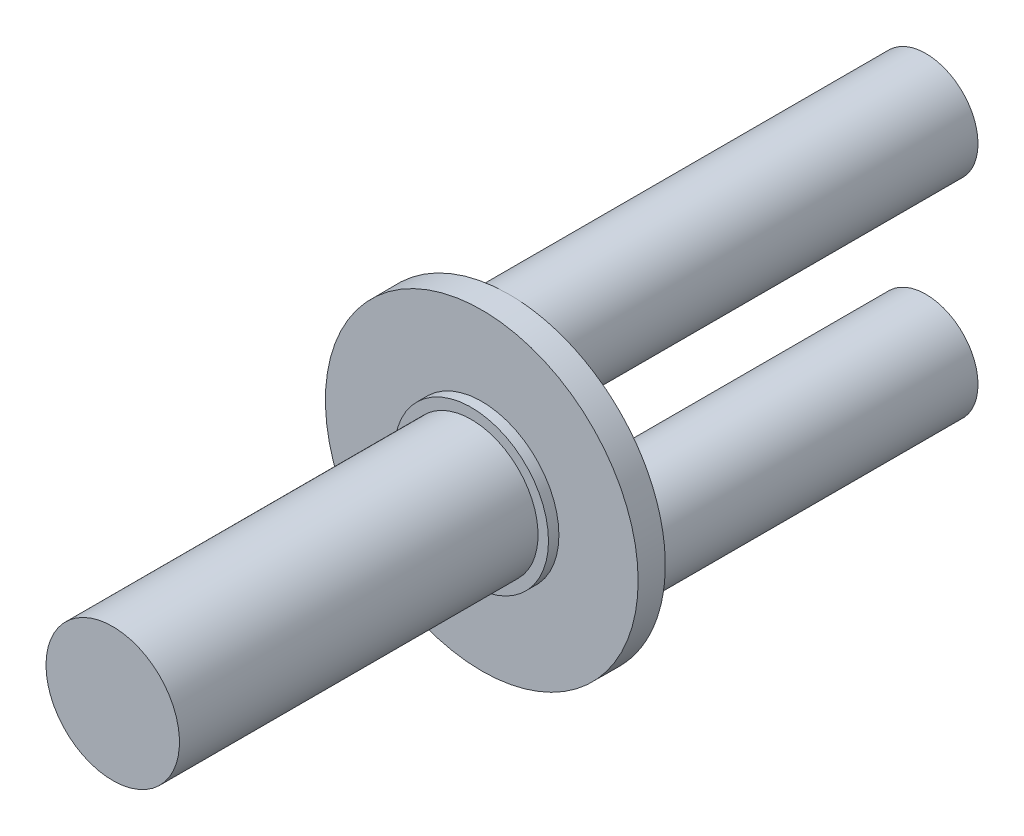
from build123d import *

# Parameters (mm, degrees)
SKETCH1_R             = 1.5875
BOSS_EXTRUDE1_DEPTH   = 12.7
BOSS_EXTRUDE1_2_DEPTH = 12.7
SKETCH2_R             = 2.032
BOSS_EXTRUDE2_DEPTH   = 12.065
SKETCH3_R             = 4.7625
BOSS_EXTRUDE3_DEPTH   = 0.8255
SKETCH4_R             = 2.3495
BOSS_EXTRUDE4_DEPTH   = 0.3175


with BuildPart() as part:
    # Sketch1 → Boss-Extrude1 (new body)
    with BuildSketch(Plane.XY):
        with Locations((0, 12.7)):
            Circle(SKETCH1_R)
    extrude(amount=-BOSS_EXTRUDE1_DEPTH)



with BuildPart() as body_2:
    # Sketch1 → Boss-Extrude1 2 (new body)
    with BuildSketch(Plane.XY):
        with Locations((0, 19.05)):
            Circle(SKETCH1_R)
    extrude(amount=-BOSS_EXTRUDE1_2_DEPTH)


with BuildPart() as part_1:
    add(part.part)

    add(body_2.part)  # Boss-Extrude2 merges body 2
    # Sketch2 → Boss-Extrude2 (add)
    with BuildSketch(Plane.XY):
        with Locations((0, 15.875)):
            Circle(SKETCH2_R)
    extrude(amount=BOSS_EXTRUDE2_DEPTH)

    # Sketch3 → Boss-Extrude3 (add)
    with BuildSketch(Plane.XY):
        with Locations((0, 15.875)):
            Circle(SKETCH3_R)
    extrude(amount=BOSS_EXTRUDE3_DEPTH)

    # Sketch4 → Boss-Extrude4 (add)
    with BuildSketch(Plane.XY.offset(0.8255)):
        with Locations((0, 15.875)):
            Circle(SKETCH4_R)
    extrude(amount=BOSS_EXTRUDE4_DEPTH)


solid = part_1.part
